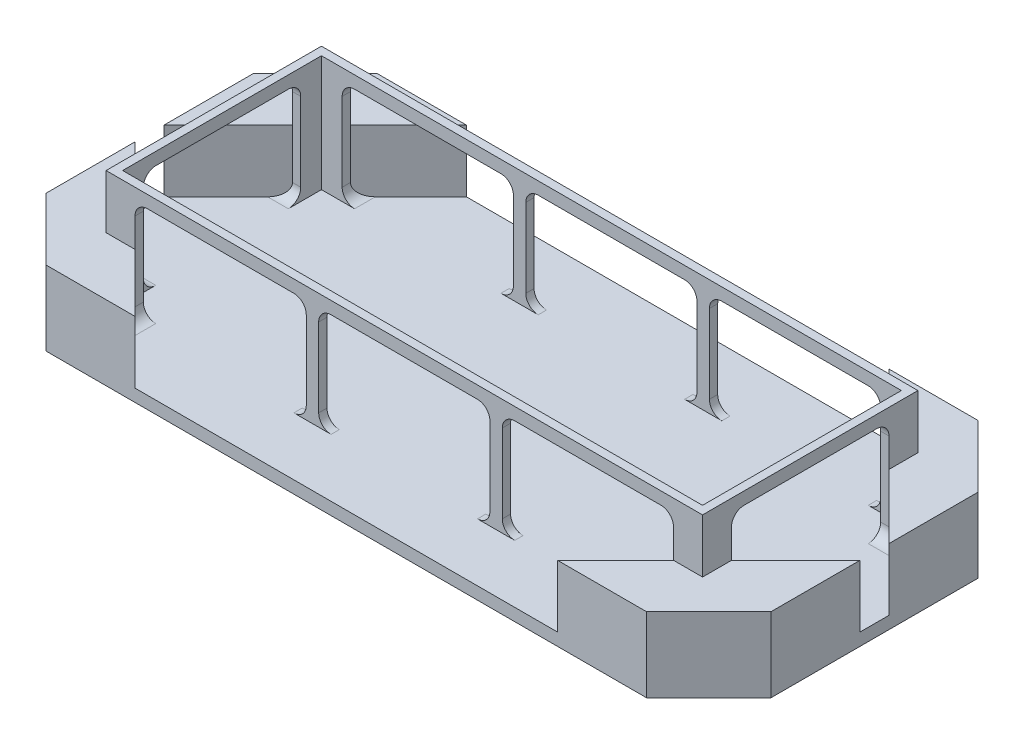
from build123d import *

# Parameters (mm, degrees)
BASE_EXTRUSION_DEPTH         = 3
SKETCH_2_W                   = 144
SKETCH_2_H                   = 52
SKETCH_2_W_2                 = 140
SKETCH_2_H_2                 = 48
BATTERY_CASE_EXTRUSION_DEPTH = 28
BATTERY_CAGE_CUT_1_REACH     = 115.9
SKETCH_3_W                   = 41.333333333
SKETCH_3_H                   = 25
BATTERY_CAGE_CUT_2_REACH     = 169.336
SKETCH_4_W                   = 38
SKETCH_4_H                   = 25
EXTRUDE_1_DEPTH              = 15
FILLET_1_R                   = 3


with BuildPart() as part:
    # Эскиз1 → Base extrusion (new body)
    with BuildSketch(Plane(origin=(0, 0, 0), x_dir=(1, 0, 0), z_dir=(0, 1, 0))):
        Polygon((-87.5, 25), (-72.5, 40), (72.5, 40), (87.5, 25), (87.5, -25), (72.5, -40), (-72.5, -40), (-87.5, -25), align=None)
    extrude(amount=BASE_EXTRUSION_DEPTH)

    # Эскиз2 → Battery case extrusion (add)
    with BuildSketch(Plane(origin=(0, 3, 0), x_dir=(1, 0, 0), z_dir=(0, 1, 0))):
        Rectangle(SKETCH_2_W, SKETCH_2_H)
        Rectangle(SKETCH_2_W_2, SKETCH_2_H_2, mode=Mode.SUBTRACT)
    extrude(amount=BATTERY_CASE_EXTRUSION_DEPTH)

    # Battery cage cut 1: up to this face of the body (flat: up to its plane)
    battery_cage_cut_1_end = Plane(part.part.faces().sort_by_distance((0, 17, -26))[0])
    # Эскиз3 → Battery cage cut 1 (cut, up to the picked face)
    with BuildSketch(Plane.XY.offset(26), mode=Mode.PRIVATE) as battery_cage_cut_1_sk1:
        with Locations((-44.333333334, 15.5)):
            Rectangle(SKETCH_3_W, SKETCH_3_H)
    battery_cage_cut_1_tool1 = split(extrude(battery_cage_cut_1_sk1.sketch, amount=-BATTERY_CAGE_CUT_1_REACH, mode=Mode.PRIVATE), bisect_by=battery_cage_cut_1_end, keep=Keep.BOTH, mode=Mode.PRIVATE)
    # Эскиз3 → Battery cage cut 1 (cut, up to the picked face)
    with BuildSketch(Plane.XY.offset(26), mode=Mode.PRIVATE) as battery_cage_cut_1_sk2:
        with Locations((-0.003333334, 15.5)):
            Rectangle(SKETCH_3_W, SKETCH_3_H)
    battery_cage_cut_1_tool2 = split(extrude(battery_cage_cut_1_sk2.sketch, amount=-BATTERY_CAGE_CUT_1_REACH, mode=Mode.PRIVATE), bisect_by=battery_cage_cut_1_end, keep=Keep.BOTH, mode=Mode.PRIVATE)
    # Эскиз3 → Battery cage cut 1 (cut, up to the picked face)
    with BuildSketch(Plane.XY.offset(26), mode=Mode.PRIVATE) as battery_cage_cut_1_sk3:
        with Locations((44.326666667, 15.5)):
            Rectangle(SKETCH_3_W, SKETCH_3_H)
    battery_cage_cut_1_tool3 = split(extrude(battery_cage_cut_1_sk3.sketch, amount=-BATTERY_CAGE_CUT_1_REACH, mode=Mode.PRIVATE), bisect_by=battery_cage_cut_1_end, keep=Keep.BOTH, mode=Mode.PRIVATE)
    add(battery_cage_cut_1_tool1.solids().sort_by(Axis((-44.333333, 15.5, 26), (0, 0, -1)))[0], mode=Mode.SUBTRACT)
    add(battery_cage_cut_1_tool2.solids().sort_by(Axis((-0.003333, 15.5, 26), (0, 0, -1)))[0], mode=Mode.SUBTRACT)
    add(battery_cage_cut_1_tool3.solids().sort_by(Axis((44.326667, 15.5, 26), (0, 0, -1)))[0], mode=Mode.SUBTRACT)

    # Battery cage cut 2: up to this face of the body (flat: up to its plane)
    battery_cage_cut_2_end = Plane(part.part.faces().sort_by_distance((72, 17, 0))[0])
    # Эскиз4 → Battery cage cut 2 (cut, up to the picked face)
    with BuildSketch(Plane.ZY.offset(72), mode=Mode.PRIVATE) as battery_cage_cut_2_sk1:
        with Locations((0, 15.5)):
            Rectangle(SKETCH_4_W, SKETCH_4_H)
    battery_cage_cut_2_tool1 = split(extrude(battery_cage_cut_2_sk1.sketch, amount=-BATTERY_CAGE_CUT_2_REACH, mode=Mode.PRIVATE), bisect_by=battery_cage_cut_2_end, keep=Keep.BOTH, mode=Mode.PRIVATE)
    add(battery_cage_cut_2_tool1.solids().sort_by(Axis((-72, 15.5, 0), (1, 0, 0)))[0], mode=Mode.SUBTRACT)

    # Эскиз6 → Бобышка-Вытянуть1 (add)
    with BuildSketch(Plane(origin=(0, 3, 0), x_dir=(1, 0, 0), z_dir=(0, 1, 0))):
        Polygon((-87.5, 25), (-72.5, 40), (-51, 40), (-65, 26), (-72, 26), (-72, 19), (-87.5, 3.5), align=None)
        Polygon((65, 26), (72, 26), (72, 19), (87.5, 3.5), (87.5, 25), (72.5, 40), (51, 40), align=None)
        Polygon((-65, -26), (-72, -26), (-72, -19), (-87.5, -3.5), (-87.5, -25), (-72.5, -40), (-51, -40), align=None)
        Polygon((65, -26), (51, -40), (72.5, -40), (87.5, -25), (87.5, -3.5), (72, -19), (72, -26), align=None)
    extrude(amount=EXTRUDE_1_DEPTH)

    # Скругление1
    fillet_1_edges = [part.edges().sort_by_distance(p)[0] for p in [
        (71, 28, -19),
        (71, 3, 19),
        (71, 3, -19),
        (71, 28, 19),
        (-71, 3, -19),
        (-71, 28, -19),
        (-71, 28, 19),
        (-71, 3, 19),
        (-65, 28, -25),
        (-23.666666667, 3, -25),
        (-65, 3, -25),
        (-23.666666667, 28, -25),
        (-65, 3, 25),
        (-65, 28, 25),
        (-23.666666667, 28, 25),
        (-23.666666667, 3, 25),
        (-20.67, 28, -25),
        (20.663333333, 3, -25),
        (20.663333333, 28, -25),
        (-20.67, 3, -25),
        (-20.67, 28, 25),
        (20.663333333, 28, 25),
        (20.663333333, 3, 25),
        (-20.67, 3, 25),
        (23.66, 28, -25),
        (64.993333333, 3, -25),
        (64.993333333, 28, -25),
        (23.66, 3, -25),
        (23.66, 28, 25),
        (64.993333333, 28, 25),
        (64.993333333, 3, 25),
        (23.66, 3, 25),
    ]]
    fillet(fillet_1_edges, radius=FILLET_1_R)


solid = part.part
